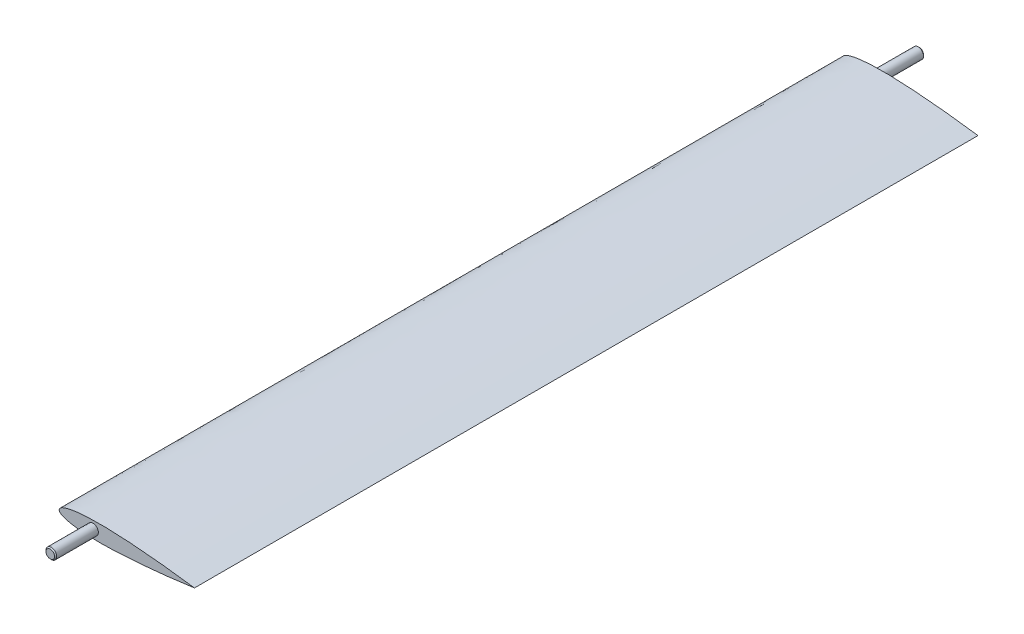
from build123d import *

# Parameters (mm, degrees)
BOSS_EXTRUDE1_DEPTH = 220
CUT_EXTRUDE4_DEPTH  = 224.267447251
BOSS_EXTRUDE2_DEPTH = 3
BOSS_EXTRUDE3_START = 220
BOSS_EXTRUDE3_DEPTH = 3
SKETCH11_R          = 1.5
BOSS_EXTRUDE4_DEPTH = 12
CHAMFER1_SIZE       = 0.3
BOSS_EXTRUDE5_START = 12
SKETCH12_R          = 1.5
BOSS_EXTRUDE5_DEPTH = 12
CHAMFER2_SIZE       = 0.3
SKETCH14_W          = 2.154355253
SKETCH14_H          = 3.365822154
CUT_EXTRUDE5_DEPTH  = 6


with BuildPart() as part:
    # Sketch1 → Boss-Extrude1 (new body)
    with BuildSketch(Plane.XY):
        with BuildLine():
            add(Edge.make_bspline(
                [(0, 0), (-2.069e-06, 0.033827122), (0.004036353, 0.087612636), (0.018820056, 0.161859527), (0.052850137, 0.253807517), (0.094763999, 0.335316283), (0.153386161, 0.42271103), (0.23687171, 0.521061127), (0.360534512, 0.637189828), (0.549922372, 0.77861813), (0.852612629, 0.955990781), (1.338381743, 1.17360275), (2.12699066, 1.436201117), (3.444824943, 1.745352538), (5.354876752, 2.027117784), (7.776486882, 2.219851109), (10.566814329, 2.298672337), (13.467597852, 2.272571107), (16.365165054, 2.167278042), (19.261849006, 2.001394171), (21.790399869, 1.815236118), (23.960988547, 1.630754303), (25.760313439, 1.463762149), (27.213041825, 1.319961918), (28.996298493, 1.135002045), (30.833566802, 0.929187427), (32.576147522, 0.724154031), (34.456040791, 0.485464125), (35.751827295, 0.31611395), (37.015459208, 0.139816801), (37.66532173, 0.047031783), (37.988862645, 0)],
                knots=[0, 0, 0, 0, 0, 0.003164261, 0.005065979, 0.007067769, 0.00918265, 0.011751939, 0.014926722, 0.019156845, 0.025079558, 0.033902813, 0.04780667, 0.069049622, 0.10302055, 0.160853133, 0.228931701, 0.297010268, 0.365088836, 0.433167406, 0.501245975, 0.569324543, 0.603363828, 0.637403113, 0.671442397, 0.705481682, 0.77356025, 0.807599534, 0.841638818, 0.875678104, 0.909426956, 0.909426956, 0.909426956, 0.909426956, 0.909426956], degree=4))
            add(Edge.make_bspline(
                [(0, 0), (-2.069e-06, -0.033827122), (0.004036353, -0.087612636), (0.018820056, -0.161859527), (0.052850137, -0.253807517), (0.094763999, -0.335316283), (0.153386161, -0.42271103), (0.23687171, -0.521061127), (0.360534512, -0.637189828), (0.549922372, -0.77861813), (0.852612629, -0.955990781), (1.338381743, -1.17360275), (2.12699066, -1.436201117), (3.444824943, -1.745352538), (5.354876752, -2.027117784), (7.776486882, -2.219851109), (10.566814329, -2.298672337), (13.467597852, -2.272571107), (16.365165054, -2.167278042), (19.261849006, -2.001394171), (21.790399869, -1.815236118), (23.960988547, -1.630754303), (25.760313439, -1.463762149), (27.213041825, -1.319961918), (28.996298493, -1.135002045), (30.833566802, -0.929187427), (32.576147522, -0.724154031), (34.456040791, -0.485464125), (35.751827295, -0.31611395), (37.015459208, -0.139816801), (37.66532173, -0.047031783), (37.988862645, 0)],
                knots=[0, 0, 0, 0, 0, 0.003164261, 0.005065979, 0.007067769, 0.00918265, 0.011751939, 0.014926722, 0.019156845, 0.025079558, 0.033902813, 0.04780667, 0.069049622, 0.10302055, 0.160853133, 0.228931701, 0.297010268, 0.365088836, 0.433167406, 0.501245975, 0.569324543, 0.603363828, 0.637403113, 0.671442397, 0.705481682, 0.77356025, 0.807599534, 0.841638818, 0.875678104, 0.909426956, 0.909426956, 0.909426956, 0.909426956, 0.909426956], degree=4))
        make_face()
    extrude(amount=BOSS_EXTRUDE1_DEPTH)

    # Sketch6 → Cut-Extrude4 (cut, through all)
    with BuildSketch(Plane.XY):
        with BuildLine():
            add(Edge.make_bspline(
                [(0.05352581, 0), (0.067606636, 0.032342125), (0.096563572, 0.088381352), (0.150275243, 0.169887664), (0.24446849, 0.279049742), (0.372671717, 0.397415308), (0.569226758, 0.541405228), (0.884881517, 0.722580333), (1.394740492, 0.945592535), (2.224848402, 1.213963956), (3.627753647, 1.530472681), (5.654751221, 1.811104593), (8.217962013, 1.993381849), (11.167056484, 2.053184879), (14.217399469, 2.003631771), (17.263614819, 1.872862295), (20.309007988, 1.680142678), (22.966553503, 1.469775774), (25.248846583, 1.263543681), (27.138936772, 1.078157692), (28.668578254, 0.918293595), (30.160471172, 0.755675098), (31.714387447, 0.574754134), (33.353433459, 0.378292676), (34.746555475, 0.197696984), (35.666757429, 0.07527997), (36.218150944, -3e-09)],
                knots=[0.005743823, 0.005743823, 0.005743823, 0.005743823, 0.005743823, 0.00889112, 0.011360053, 0.014425442, 0.018582281, 0.024427351, 0.033055875, 0.046836986, 0.068146734, 0.102160407, 0.161217752, 0.229245254, 0.297272761, 0.365300268, 0.433327776, 0.501355284, 0.569382792, 0.603396546, 0.6374103, 0.671424054, 0.705437808, 0.739451562, 0.773465317, 0.824408571, 0.824408571, 0.824408571, 0.824408571, 0.824408571], degree=4))
            add(Edge.make_bspline(
                [(0.05352581, 0), (0.067606636, -0.032342126), (0.096563572, -0.088381352), (0.150275243, -0.169887664), (0.24446849, -0.279049742), (0.372671717, -0.397415308), (0.569226758, -0.541405228), (0.884881517, -0.722580333), (1.394740491, -0.945592535), (2.224848402, -1.213963956), (3.627753647, -1.530472682), (5.654751221, -1.811104594), (8.217962012, -1.99338185), (11.167056483, -2.053184881), (14.217399468, -2.003631773), (17.263614818, -1.872862298), (20.309007987, -1.680142682), (22.966553503, -1.469775778), (25.248846583, -1.263543685), (27.138936772, -1.078157697), (28.668578254, -0.9182936), (30.160471172, -0.755675103), (31.714387446, -0.574754139), (33.353433459, -0.378292682), (34.746555475, -0.19769699), (35.666757429, -0.075279976), (36.218150944, -3e-09)],
                knots=[0.005743823, 0.005743823, 0.005743823, 0.005743823, 0.005743823, 0.00889112, 0.011360053, 0.014425442, 0.018582281, 0.024427351, 0.033055875, 0.046836986, 0.068146734, 0.102160407, 0.161217752, 0.229245254, 0.297272761, 0.365300268, 0.433327776, 0.501355284, 0.569382792, 0.603396546, 0.6374103, 0.671424054, 0.705437808, 0.739451562, 0.773465317, 0.824408571, 0.824408571, 0.824408571, 0.824408571, 0.824408571], degree=4))
        make_face()
    extrude(amount=CUT_EXTRUDE4_DEPTH, mode=Mode.SUBTRACT)

    # Sketch8 → Boss-Extrude2 (add)
    with BuildSketch(Plane.XY):
        with BuildLine():
            add(Edge.make_bspline(
                [(0, 0), (-2.069e-06, 0.033827122), (0.004036353, 0.087612636), (0.018820056, 0.161859527), (0.052850137, 0.253807517), (0.094763999, 0.335316283), (0.153386161, 0.42271103), (0.23687171, 0.521061127), (0.360534512, 0.637189828), (0.549922372, 0.77861813), (0.852612629, 0.955990781), (1.338381743, 1.17360275), (2.12699066, 1.436201117), (3.444824943, 1.745352538), (5.354876752, 2.027117784), (7.776486882, 2.219851109), (10.566814329, 2.298672337), (13.467597852, 2.272571107), (16.365165054, 2.167278042), (19.261849006, 2.001394171), (21.790399869, 1.815236118), (23.960988547, 1.630754303), (25.760313439, 1.463762149), (27.213041825, 1.319961918), (28.996298493, 1.135002045), (30.833566802, 0.929187427), (32.576147522, 0.724154031), (34.456040791, 0.485464125), (35.751827295, 0.31611395), (37.015459208, 0.139816801), (37.66532173, 0.047031783), (37.988862645, 0)],
                knots=[0, 0, 0, 0, 0, 0.003164261, 0.005065979, 0.007067769, 0.00918265, 0.011751939, 0.014926722, 0.019156845, 0.025079558, 0.033902813, 0.04780667, 0.069049622, 0.10302055, 0.160853133, 0.228931701, 0.297010268, 0.365088836, 0.433167406, 0.501245975, 0.569324543, 0.603363828, 0.637403113, 0.671442397, 0.705481682, 0.77356025, 0.807599534, 0.841638818, 0.875678104, 0.909426956, 0.909426956, 0.909426956, 0.909426956, 0.909426956], degree=4))
            add(Edge.make_bspline(
                [(0, 0), (-2.069e-06, -0.033827122), (0.004036353, -0.087612636), (0.018820056, -0.161859527), (0.052850137, -0.253807517), (0.094763999, -0.335316283), (0.153386161, -0.42271103), (0.23687171, -0.521061127), (0.360534512, -0.637189828), (0.549922372, -0.77861813), (0.852612629, -0.955990781), (1.338381743, -1.17360275), (2.12699066, -1.436201117), (3.444824943, -1.745352538), (5.354876752, -2.027117784), (7.776486882, -2.219851109), (10.566814329, -2.298672337), (13.467597852, -2.272571107), (16.365165054, -2.167278042), (19.261849006, -2.001394171), (21.790399869, -1.815236118), (23.960988547, -1.630754303), (25.760313439, -1.463762149), (27.213041825, -1.319961918), (28.996298493, -1.135002045), (30.833566802, -0.929187427), (32.576147522, -0.724154031), (34.456040791, -0.485464125), (35.751827295, -0.31611395), (37.015459208, -0.139816801), (37.66532173, -0.047031783), (37.988862645, 0)],
                knots=[0, 0, 0, 0, 0, 0.003164261, 0.005065979, 0.007067769, 0.00918265, 0.011751939, 0.014926722, 0.019156845, 0.025079558, 0.033902813, 0.04780667, 0.069049622, 0.10302055, 0.160853133, 0.228931701, 0.297010268, 0.365088836, 0.433167406, 0.501245975, 0.569324543, 0.603363828, 0.637403113, 0.671442397, 0.705481682, 0.77356025, 0.807599534, 0.841638818, 0.875678104, 0.909426956, 0.909426956, 0.909426956, 0.909426956, 0.909426956], degree=4))
        make_face()
    extrude(amount=BOSS_EXTRUDE2_DEPTH)

    # Sketch9 → Boss-Extrude3 (add)
    with BuildSketch(Plane.XY.offset(BOSS_EXTRUDE3_START)):
        with BuildLine():
            add(Edge.make_bspline(
                [(0, 0), (-2.069e-06, 0.033827122), (0.004036353, 0.087612636), (0.018820056, 0.161859527), (0.052850137, 0.253807517), (0.094763999, 0.335316283), (0.153386161, 0.42271103), (0.23687171, 0.521061127), (0.360534512, 0.637189828), (0.549922372, 0.77861813), (0.852612629, 0.955990781), (1.338381743, 1.17360275), (2.12699066, 1.436201117), (3.444824943, 1.745352538), (5.354876752, 2.027117784), (7.776486882, 2.219851109), (10.566814329, 2.298672337), (13.467597852, 2.272571107), (16.365165054, 2.167278042), (19.261849006, 2.001394171), (21.790399869, 1.815236118), (23.960988547, 1.630754303), (25.760313439, 1.463762149), (27.213041825, 1.319961918), (28.996298493, 1.135002045), (30.833566802, 0.929187427), (32.576147522, 0.724154031), (34.456040791, 0.485464125), (35.751827295, 0.31611395), (37.015459208, 0.139816801), (37.66532173, 0.047031783), (37.988862645, 0)],
                knots=[0, 0, 0, 0, 0, 0.003164261, 0.005065979, 0.007067769, 0.00918265, 0.011751939, 0.014926722, 0.019156845, 0.025079558, 0.033902813, 0.04780667, 0.069049622, 0.10302055, 0.160853133, 0.228931701, 0.297010268, 0.365088836, 0.433167406, 0.501245975, 0.569324543, 0.603363828, 0.637403113, 0.671442397, 0.705481682, 0.77356025, 0.807599534, 0.841638818, 0.875678104, 0.909426956, 0.909426956, 0.909426956, 0.909426956, 0.909426956], degree=4))
            add(Edge.make_bspline(
                [(0, 0), (-2.069e-06, -0.033827122), (0.004036353, -0.087612636), (0.018820056, -0.161859527), (0.052850137, -0.253807517), (0.094763999, -0.335316283), (0.153386161, -0.42271103), (0.23687171, -0.521061127), (0.360534512, -0.637189828), (0.549922372, -0.77861813), (0.852612629, -0.955990781), (1.338381743, -1.17360275), (2.12699066, -1.436201117), (3.444824943, -1.745352538), (5.354876752, -2.027117784), (7.776486882, -2.219851109), (10.566814329, -2.298672337), (13.467597852, -2.272571107), (16.365165054, -2.167278042), (19.261849006, -2.001394171), (21.790399869, -1.815236118), (23.960988547, -1.630754303), (25.760313439, -1.463762149), (27.213041825, -1.319961918), (28.996298493, -1.135002045), (30.833566802, -0.929187427), (32.576147522, -0.724154031), (34.456040791, -0.485464125), (35.751827295, -0.31611395), (37.015459208, -0.139816801), (37.66532173, -0.047031783), (37.988862645, 0)],
                knots=[0, 0, 0, 0, 0, 0.003164261, 0.005065979, 0.007067769, 0.00918265, 0.011751939, 0.014926722, 0.019156845, 0.025079558, 0.033902813, 0.04780667, 0.069049622, 0.10302055, 0.160853133, 0.228931701, 0.297010268, 0.365088836, 0.433167406, 0.501245975, 0.569324543, 0.603363828, 0.637403113, 0.671442397, 0.705481682, 0.77356025, 0.807599534, 0.841638818, 0.875678104, 0.909426956, 0.909426956, 0.909426956, 0.909426956, 0.909426956], degree=4))
        make_face()
    extrude(amount=-BOSS_EXTRUDE3_DEPTH)

    # Sketch11 → Boss-Extrude4 (add)
    with BuildSketch(Plane.XY.offset(220)):
        with Locations((9.5, 0)):
            Circle(SKETCH11_R)
    extrude(amount=BOSS_EXTRUDE4_DEPTH)

    # Chamfer1
    chamfer1_edges = [part.edges().sort_by_distance(p)[0] for p in [
        (8, 0, 232),
    ]]
    chamfer(chamfer1_edges, length=CHAMFER1_SIZE)

    # Sketch12 → Boss-Extrude5 (add)
    with BuildSketch(Plane(origin=(0, 0, 0), x_dir=(-1, 0, 0), z_dir=(0, 0, -1)).offset(BOSS_EXTRUDE5_START)):
        with Locations(Location((-9.5, 0, 0), (0, 0, 180))):
            Circle(SKETCH12_R)
    extrude(amount=-BOSS_EXTRUDE5_DEPTH)

    # Chamfer2
    chamfer2_edges = [part.edges().sort_by_distance(p)[0] for p in [
        (8, 0, -12),
    ]]
    chamfer(chamfer2_edges, length=CHAMFER2_SIZE)

    # Sketch14 → Cut-Extrude5 (cut)
    with BuildSketch(Plane(origin=(0, 0, -12), x_dir=(-1, 0, 0), z_dir=(0, 0, -1))):
        with Locations((-7.422822374, 0.06703857)):
            Rectangle(SKETCH14_W, SKETCH14_H)
    extrude(amount=-CUT_EXTRUDE5_DEPTH, mode=Mode.SUBTRACT)


solid = part.part
